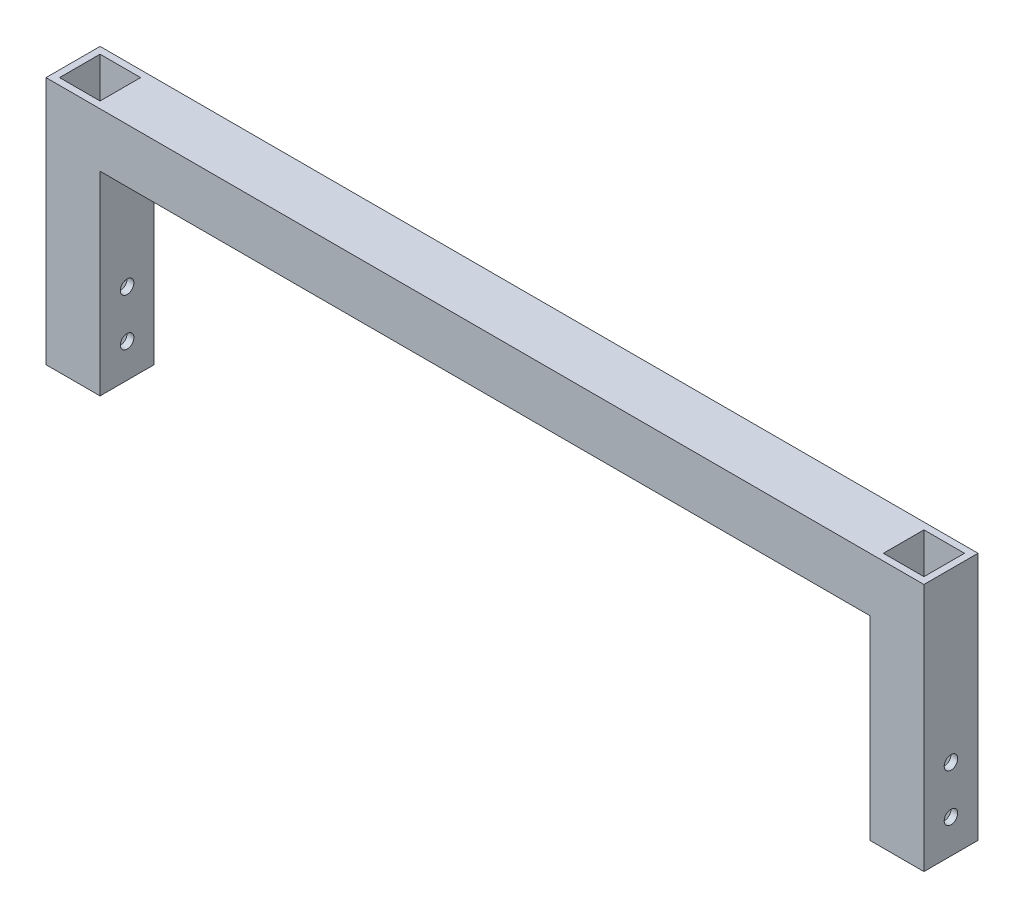
from build123d import *

# Parameters (mm, degrees)
SKETCH1_W           = 25.4
SKETCH1_H           = 25.4
SKETCH1_W_2         = 19.05
SKETCH1_H_2         = 19.05
BOSS_EXTRUDE1_DEPTH = 116.84
SKETCH2_R           = 3.175
CUT_EXTRUDE1_DEPTH  = 25.4
SKETCH4_W           = 25.4
SKETCH4_H           = 25.4
SKETCH4_W_2         = 19.05
SKETCH4_H_2         = 19.05
BOSS_EXTRUDE2_DEPTH = 180.848


with BuildPart() as part:
    # Sketch1 → Boss-Extrude1 (new body)
    with BuildSketch(Plane(origin=(0, 0, 0), x_dir=(1, 0, 0), z_dir=(0, 1, 0))):
        with Locations((9.525, 9.525)):
            Rectangle(SKETCH1_W, SKETCH1_H)
        with Locations((9.525, 9.525)):
            Rectangle(SKETCH1_W_2, SKETCH1_H_2, mode=Mode.SUBTRACT)
    boss_extrude1 = extrude(amount=BOSS_EXTRUDE1_DEPTH)

    # Sketch2 → Cut-Extrude1 (cut)
    with BuildSketch(Plane.ZY.offset(3.175)):
        with Locations((-9.525, 15.875)):
            Circle(SKETCH2_R)
        with Locations((-9.525, 38.1)):
            Circle(SKETCH2_R)
    cut_extrude1 = extrude(amount=-CUT_EXTRUDE1_DEPTH, mode=Mode.SUBTRACT)

    # Sketch4 → Boss-Extrude2 (add)
    with BuildSketch(Plane(origin=(22.225, 0, 0), x_dir=(0, 0, -1), z_dir=(1, 0, 0))):
        with Locations((9.525, 104.14)):
            Rectangle(SKETCH4_W, SKETCH4_H)
        with Locations((9.525, 104.14)):
            Rectangle(SKETCH4_W_2, SKETCH4_H_2, mode=Mode.SUBTRACT)
    boss_extrude2 = extrude(amount=BOSS_EXTRUDE2_DEPTH)

    # Mirror2: Boss-Extrude2 across plane
    add(boss_extrude2.mirror(Plane(origin=(203.073, 0, 0), x_dir=(0, 0, 1), z_dir=(1, 0, 0))))

    # Mirror4: Boss-Extrude1, Cut-Extrude1 across plane
    add(boss_extrude1.mirror(Plane(origin=(203.073, 0, 0), x_dir=(0, 0, 1), z_dir=(1, 0, 0))))
    add(cut_extrude1.mirror(Plane(origin=(203.073, 0, 0), x_dir=(0, 0, 1), z_dir=(1, 0, 0))), mode=Mode.SUBTRACT)


solid = part.part
